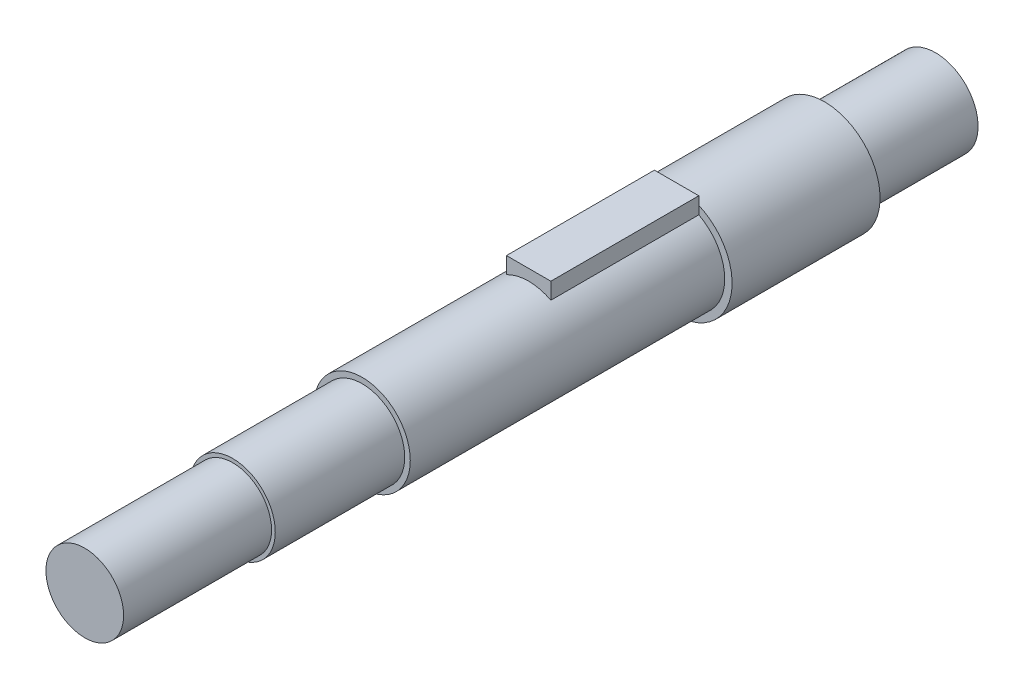
from build123d import *

# Parameters (mm, degrees)
SKETCH2_R           = 15
BOSS_EXTRUDE1_DEPTH = 230
CUT_EXTRUDE1_START  = -160
SKETCH3_R           = 15
SKETCH3_R_2         = 13
CUT_EXTRUDE1_DEPTH  = 160
CUT_EXTRUDE3_START  = -75
SKETCH4_R           = 13
SKETCH4_R_2         = 11.5
CUT_EXTRUDE3_DEPTH  = 75
CUT_EXTRUDE4_START  = -40
SKETCH5_R           = 11.5
SKETCH5_R_2         = 10.5
CUT_EXTRUDE4_DEPTH  = 40
SKETCH6_R           = 15
SKETCH6_R_2         = 11.5
CUT_EXTRUDE5_DEPTH  = 30
BOSS_EXTRUDE2_DEPTH = 40


with BuildPart() as part:
    # Sketch2 → Boss-Extrude1 (new body)
    with BuildSketch(Plane.XY):
        Circle(SKETCH2_R)
    extrude(amount=BOSS_EXTRUDE1_DEPTH)

    # Sketch3 → Cut-Extrude1 (cut)
    with BuildSketch(Plane.XY.offset(230).offset(CUT_EXTRUDE1_START)):
        Circle(SKETCH3_R)
        Circle(SKETCH3_R_2, mode=Mode.SUBTRACT)
    extrude(amount=CUT_EXTRUDE1_DEPTH, mode=Mode.SUBTRACT)

    # Sketch4 → Cut-Extrude3 (cut)
    with BuildSketch(Plane.XY.offset(230).offset(CUT_EXTRUDE3_START)):
        Circle(SKETCH4_R)
        Circle(SKETCH4_R_2, mode=Mode.SUBTRACT)
    extrude(amount=CUT_EXTRUDE3_DEPTH, mode=Mode.SUBTRACT)

    # Sketch5 → Cut-Extrude4 (cut)
    with BuildSketch(Plane.XY.offset(230).offset(CUT_EXTRUDE4_START)):
        Circle(SKETCH5_R)
        Circle(SKETCH5_R_2, mode=Mode.SUBTRACT)
    extrude(amount=CUT_EXTRUDE4_DEPTH, mode=Mode.SUBTRACT)

    # Sketch6 → Cut-Extrude5 (cut)
    with BuildSketch(Plane(origin=(0, 0, 0), x_dir=(-1, 0, 0), z_dir=(0, 0, -1))):
        Circle(SKETCH6_R)
        with Locations(Location((0, 0, 0), (0, 0, 180))):
            Circle(SKETCH6_R_2, mode=Mode.SUBTRACT)
    extrude(amount=-CUT_EXTRUDE5_DEPTH, mode=Mode.SUBTRACT)

    # Sketch8 → Boss-Extrude2 (add)
    with BuildSketch(Plane.XY.offset(70)):
        with BuildLine():
            Line((-6, 16), (6, 16))
            Line((6, 16), (6, 11.532562595))
            ThreePointArc((6, 11.532562595), (0, 13), (-6, 11.532562595))
            Line((-6, 11.532562595), (-6, 16))
        make_face()
    extrude(amount=BOSS_EXTRUDE2_DEPTH)


solid = part.part
